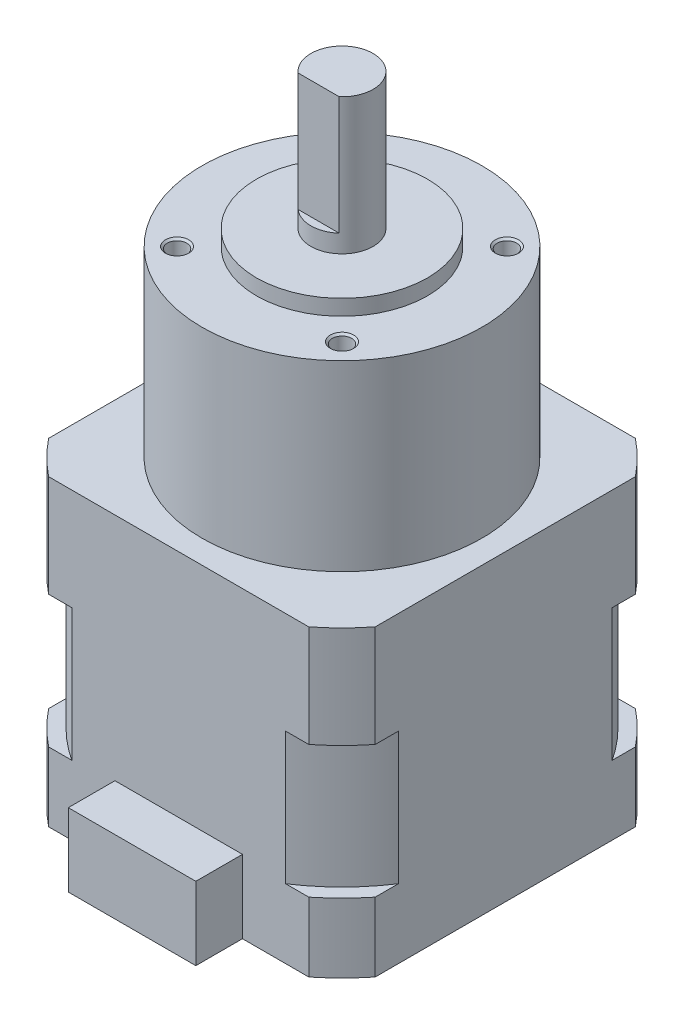
from build123d import *

# Parameters (mm, degrees)
SZKIC1_W                         = 42
SZKIC1_H                         = 42
DODANIE_WYCI_GNI_CIE1_DEPTH      = 39
SZKIC1_3_R                       = 18
DODANIE_WYCI_GNI_CIE2_DEPTH      = 62.5
SZKIC1_4_R                       = 11
DODANIE_WYCI_GNI_CIE3_DEPTH      = 64.5
SZKIC1_5_R                       = 4
DODANIE_WYCI_GNI_CIE4_DEPTH      = 66.8
DODANIE_WYCI_GNI_CIE5_DEPTH      = 82
SZKIC2_OUTSIDE_W                 = 64.25
SZKIC2_OUTSIDE_H                 = 64.25
SZKIC2_OUTSIDE_R                 = 26.85
WYTNIJ_WYCI_GNI_CIE2_DEPTH       = 88.212384442
WYTNIJ_WYCI_GNI_CIE3_START       = 8.9
SZKIC3_OUTSIDE_W                 = 64.25
SZKIC3_OUTSIDE_H                 = 64.25
SZKIC3_OUTSIDE_R                 = 25.1
WYTNIJ_WYCI_GNI_CIE3_DEPTH       = 17
SZKIC4_R                         = 4.65
WYTNIJ_WYCI_GNI_CIE5_DEPTH       = 4
OTW_R_GWINTOWANY_M31_D           = 2.5
OTW_R_GWINTOWANY_M31_DEPTH       = 9
OTW_R_GWINTOWANY_M31_CSINK_D     = 3
OTW_R_GWINTOWANY_M31_CSINK_ANGLE = 90
OTW_R_GWINTOWANY_M31_TIP         = 0.751075774
DODANIE_WYCI_GNI_CIE6_START      = 21
SZKIC18_W                        = 16.4
SZKIC18_H                        = 9.4
DODANIE_WYCI_GNI_CIE6_DEPTH      = 6


with BuildPart() as part:
    # Szkic1 → Dodanie-wyciągnięcie1 (new body)
    with BuildSketch(Plane(origin=(0, 0, 0), x_dir=(1, 0, 0), z_dir=(0, 1, 0))):
        Rectangle(SZKIC1_W, SZKIC1_H)
    extrude(amount=DODANIE_WYCI_GNI_CIE1_DEPTH)

    # Szkic1<3> → Dodanie-wyciągnięcie2 (add)
    with BuildSketch(Plane(origin=(0, 0, 0), x_dir=(1, 0, 0), z_dir=(0, 1, 0))):
        with Locations(Location((0, 0, 0), (0, 0, 270))):
            Circle(SZKIC1_3_R)
    extrude(amount=DODANIE_WYCI_GNI_CIE2_DEPTH)

    # Szkic1<4> → Dodanie-wyciągnięcie3 (add)
    with BuildSketch(Plane(origin=(0, 0, 0), x_dir=(1, 0, 0), z_dir=(0, 1, 0))):
        with Locations(Location((0, 0, 0), (0, 0, 270))):
            Circle(SZKIC1_4_R)
    extrude(amount=DODANIE_WYCI_GNI_CIE3_DEPTH)

    # Szkic1<5> → Dodanie-wyciągnięcie4 (add)
    with BuildSketch(Plane(origin=(0, 0, 0), x_dir=(1, 0, 0), z_dir=(0, 1, 0))):
        with Locations(Location((0, 0, 0), (0, 0, 270))):
            Circle(SZKIC1_5_R)
    extrude(amount=DODANIE_WYCI_GNI_CIE4_DEPTH)

    # Szkic1<6> → Dodanie-wyciągnięcie5 (add)
    with BuildSketch(Plane(origin=(0, 0, 0), x_dir=(1, 0, 0), z_dir=(0, 1, 0))):
        with BuildLine():
            Line((-2.645751311, -3), (2.645751311, -3))
            ThreePointArc((2.645751311, -3), (0, 4), (-2.645751311, -3))
        make_face()
    extrude(amount=DODANIE_WYCI_GNI_CIE5_DEPTH)

    # Szkic2 outside → Wytnij-wyciągnięcie2 (cut, through all)
    with BuildSketch(Plane(origin=(0, 0, 0), x_dir=(1, 0, 0), z_dir=(0, 1, 0))):
        Rectangle(SZKIC2_OUTSIDE_W, SZKIC2_OUTSIDE_H)
        Circle(SZKIC2_OUTSIDE_R, mode=Mode.SUBTRACT)
    extrude(amount=WYTNIJ_WYCI_GNI_CIE2_DEPTH, mode=Mode.SUBTRACT)

    # Szkic3 outside → Wytnij-wyciągnięcie3 (cut)
    with BuildSketch(Plane(origin=(0, 0, 0), x_dir=(1, 0, 0), z_dir=(0, 1, 0)).offset(WYTNIJ_WYCI_GNI_CIE3_START)):
        Rectangle(SZKIC3_OUTSIDE_W, SZKIC3_OUTSIDE_H)
        Circle(SZKIC3_OUTSIDE_R, mode=Mode.SUBTRACT)
    extrude(amount=WYTNIJ_WYCI_GNI_CIE3_DEPTH, mode=Mode.SUBTRACT)

    # Szkic4 → Wytnij-wyciągnięcie5 (cut)
    with BuildSketch(Plane(origin=(0, 0, 0), x_dir=(1, 0, 0), z_dir=(0, 1, 0))):
        with Locations(Location((0, 0, 0), (0, 0, 270))):
            Circle(SZKIC4_R)
    extrude(amount=WYTNIJ_WYCI_GNI_CIE5_DEPTH, mode=Mode.SUBTRACT)

    # Otwór gwintowany M31
    with Locations(Plane(origin=(0, 62.5, 0), x_dir=(1, 0, 0), z_dir=(0, 1, 0))):
        with Locations((-10.606601718, 10.606601718), (10.606601718, 10.606601718), (10.606601718, -10.606601718), (-10.606601718, -10.606601718)):
            CounterSinkHole(OTW_R_GWINTOWANY_M31_D / 2, OTW_R_GWINTOWANY_M31_CSINK_D / 2, depth=OTW_R_GWINTOWANY_M31_DEPTH, counter_sink_angle=OTW_R_GWINTOWANY_M31_CSINK_ANGLE)
            with Locations((0, 0, -(OTW_R_GWINTOWANY_M31_DEPTH + OTW_R_GWINTOWANY_M31_TIP / 2))):  # 118° drill point
                Cone(0, OTW_R_GWINTOWANY_M31_D / 2, OTW_R_GWINTOWANY_M31_TIP, mode=Mode.SUBTRACT)

    # Szkic18 → Dodanie-wyciągnięcie6 (add)
    with BuildSketch(Plane.XY.offset(DODANIE_WYCI_GNI_CIE6_START)):
        with Locations((0, 4.7)):
            Rectangle(SZKIC18_W, SZKIC18_H)
    extrude(amount=DODANIE_WYCI_GNI_CIE6_DEPTH)


solid = part.part
